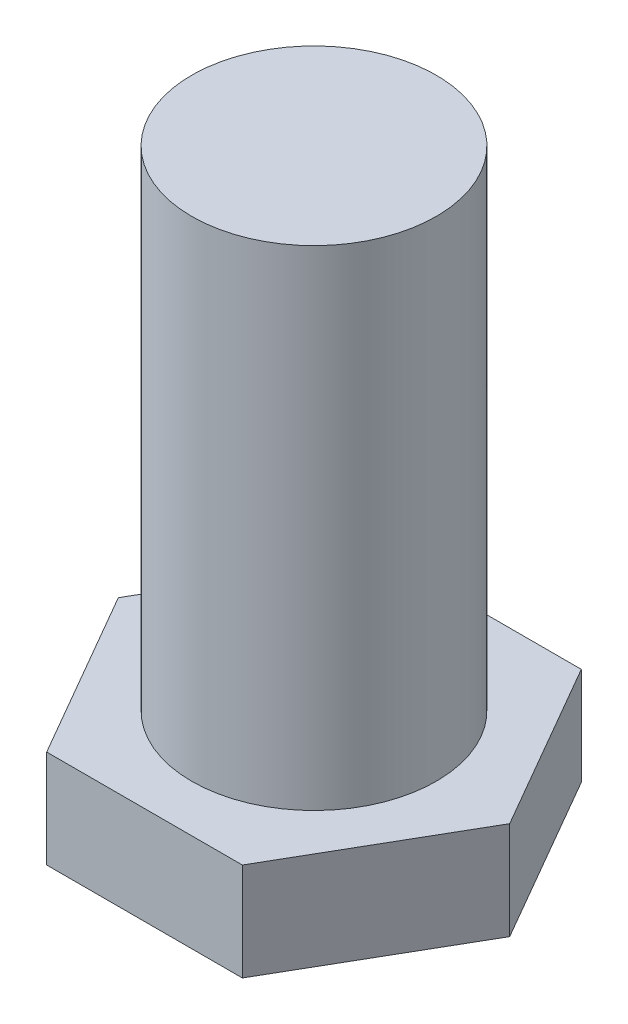
from build123d import *

# Parameters (mm, degrees)
EXTRUDE_1_DEPTH = 2
SKETCH_2_R      = 2.5
EXTRUDE_2_DEPTH = 10


with BuildPart() as part:
    # 草图1 → 凸台-拉伸1 (new body)
    with BuildSketch(Plane(origin=(0, 0, 0), x_dir=(1, 0, 0), z_dir=(0, 1, 0))):
        Polygon((4, 0), (2, 3.464101615), (-2, 3.464101615), (-4, 0), (-2, -3.464101615), (2, -3.464101615), align=None)
    extrude(amount=EXTRUDE_1_DEPTH)

    # 草图2 → 凸台-拉伸2 (add)
    with BuildSketch(Plane(origin=(0, 2, 0), x_dir=(1, 0, 0), z_dir=(0, 1, 0))):
        with Locations(Location((0, 0, 0), (0, 0, 270))):
            Circle(SKETCH_2_R)
    extrude(amount=EXTRUDE_2_DEPTH)


solid = part.part
